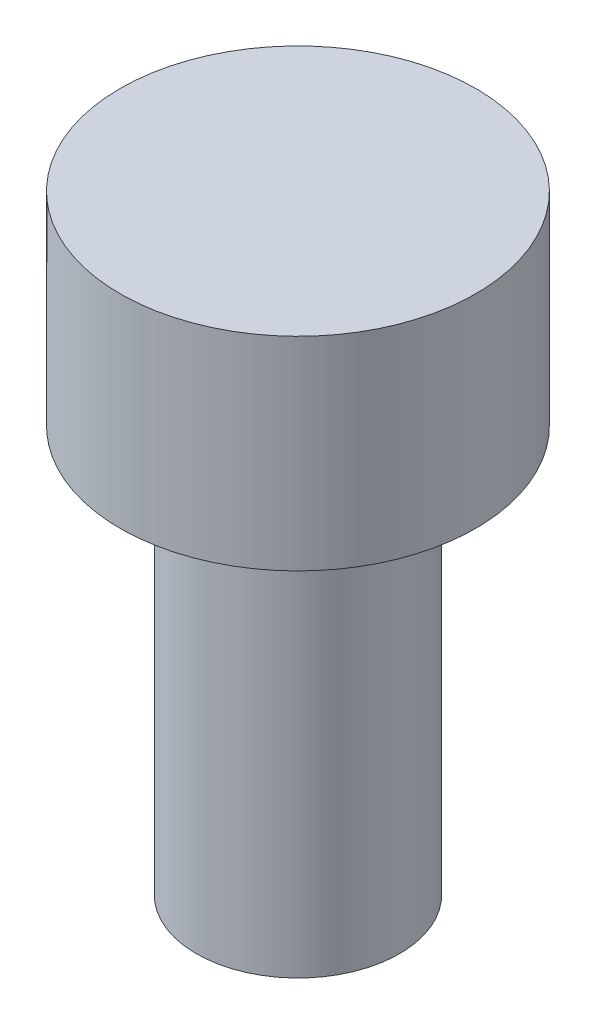
from build123d import *


with BuildPart() as part:
    # Sketch1 → Revolve1 (revolve)
    with BuildSketch(Plane.XY, mode=Mode.PRIVATE) as revolve1_sk:
        Polygon((0, 12), (0, 0), (2, 0), (2, 8), (3.5, 8), (3.5, 12), align=None)
    revolve(revolve1_sk.sketch.rotate(Axis((0, 12, 0), (0, -1, 0)), 180), axis=Axis((0, 12, 0), (0, -1, 0)))


solid = part.part
